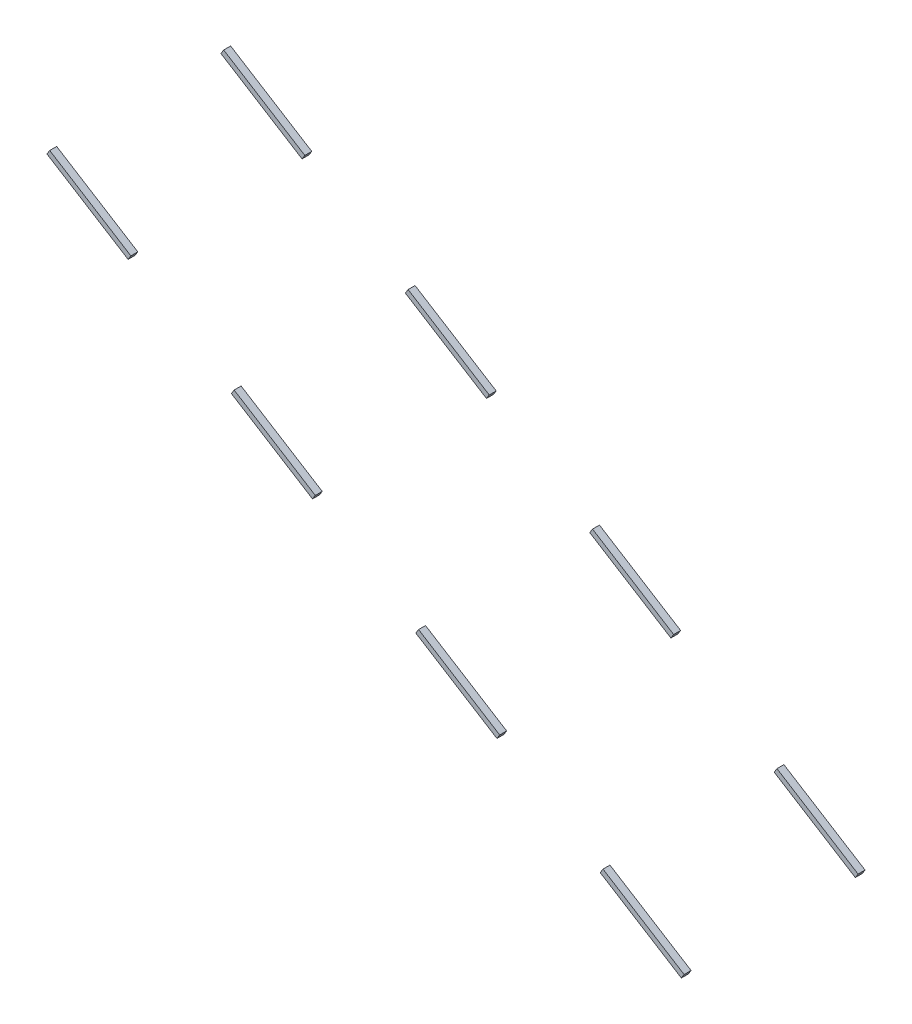
from build123d import *

# Parameters (mm, degrees)
S1_110X8X6_SCHEMATIC_START = 146
S1_110X8X6_SCHEMATIC_DEPTH = 8
S2_110X8X6_SCHEMATIC_START = 146
S2_110X8X6_SCHEMATIC_DEPTH = 8
S3_110X8X6_SCHEMATIC_START = 146
S3_110X8X6_SCHEMATIC_DEPTH = 8
S4_110X8X6_SCHEMATIC_START = 146
S4_110X8X6_SCHEMATIC_DEPTH = 8
S5_110X8X6_SCHEMATIC_START = 346
S5_110X8X6_SCHEMATIC_DEPTH = 8
S6_110X8X6_SCHEMATIC_START = 346
S6_110X8X6_SCHEMATIC_DEPTH = 8
S7_110X8X6_SCHEMATIC_START = 346
S7_110X8X6_SCHEMATIC_DEPTH = 8
S8_110X8X6_SCHEMATIC_START = 346
S8_110X8X6_SCHEMATIC_DEPTH = 8


with BuildPart() as part:
    # 草图1 → S1_110x8x6_SCHEMATIC (new body)
    with BuildSketch(Plane.XY.offset(S1_110X8X6_SCHEMATIC_START)):
        Polygon((228.970379508, 604.202695295), (322.255670085, 545.911576229), (325.43518567, 550.999864806), (232.149895093, 609.290983872), align=None)
    extrude(amount=S1_110X8X6_SCHEMATIC_DEPTH)


with BuildPart() as body_2:
    # 草图2 → S2_110x8x6_SCHEMATIC (new body)
    with BuildSketch(Plane.XY.offset(S2_110X8X6_SCHEMATIC_START)):
        Polygon((440.982403547, 471.722879236), (534.267694124, 413.431760171), (537.447209709, 418.520048748), (444.161919132, 476.811167813), align=None)
    extrude(amount=S2_110X8X6_SCHEMATIC_DEPTH)


with BuildPart() as body_3:
    # 草图3 → S3_110x8x6_SCHEMATIC (new body)
    with BuildSketch(Plane.XY.offset(S3_110X8X6_SCHEMATIC_START)):
        Polygon((652.994427586, 339.243063178), (746.279718163, 280.951944112), (749.459233748, 286.040232689), (656.173943171, 344.331351755), align=None)
    extrude(amount=S3_110X8X6_SCHEMATIC_DEPTH)


with BuildPart() as body_4:
    # 草图4 → S4_110x8x6_SCHEMATIC (new body)
    with BuildSketch(Plane.XY.offset(S4_110X8X6_SCHEMATIC_START)):
        Polygon((865.006451625, 206.76324712), (958.291742202, 148.472128054), (961.471257788, 153.560416631), (868.18596721, 211.851535697), align=None)
    extrude(amount=S4_110X8X6_SCHEMATIC_DEPTH)


with BuildPart() as body_5:
    # 草图5 → S5_110x8x6_SCHEMATIC (new body)
    with BuildSketch(Plane.XY.offset(S5_110X8X6_SCHEMATIC_START)):
        Polygon((228.970379508, 604.202695295), (322.255670085, 545.911576229), (325.43518567, 550.999864806), (232.149895093, 609.290983872), align=None)
    extrude(amount=S5_110X8X6_SCHEMATIC_DEPTH)


with BuildPart() as body_6:
    # 草图6 → S6_110x8x6_SCHEMATIC (new body)
    with BuildSketch(Plane.XY.offset(S6_110X8X6_SCHEMATIC_START)):
        Polygon((440.982403547, 471.722879236), (534.267694124, 413.431760171), (537.447209709, 418.520048748), (444.161919132, 476.811167813), align=None)
    extrude(amount=S6_110X8X6_SCHEMATIC_DEPTH)


with BuildPart() as body_7:
    # 草图7 → S7_110x8x6_SCHEMATIC (new body)
    with BuildSketch(Plane.XY.offset(S7_110X8X6_SCHEMATIC_START)):
        Polygon((652.994427586, 339.243063178), (746.279718163, 280.951944112), (749.459233748, 286.040232689), (656.173943171, 344.331351755), align=None)
    extrude(amount=S7_110X8X6_SCHEMATIC_DEPTH)


with BuildPart() as body_8:
    # 草图8 → S8_110x8x6_SCHEMATIC (new body)
    with BuildSketch(Plane.XY.offset(S8_110X8X6_SCHEMATIC_START)):
        Polygon((865.006451625, 206.76324712), (958.291742202, 148.472128054), (961.471257788, 153.560416631), (868.18596721, 211.851535697), align=None)
    extrude(amount=S8_110X8X6_SCHEMATIC_DEPTH)


solid = Compound([part.part, body_2.part, body_3.part, body_4.part, body_5.part, body_6.part, body_7.part, body_8.part])
